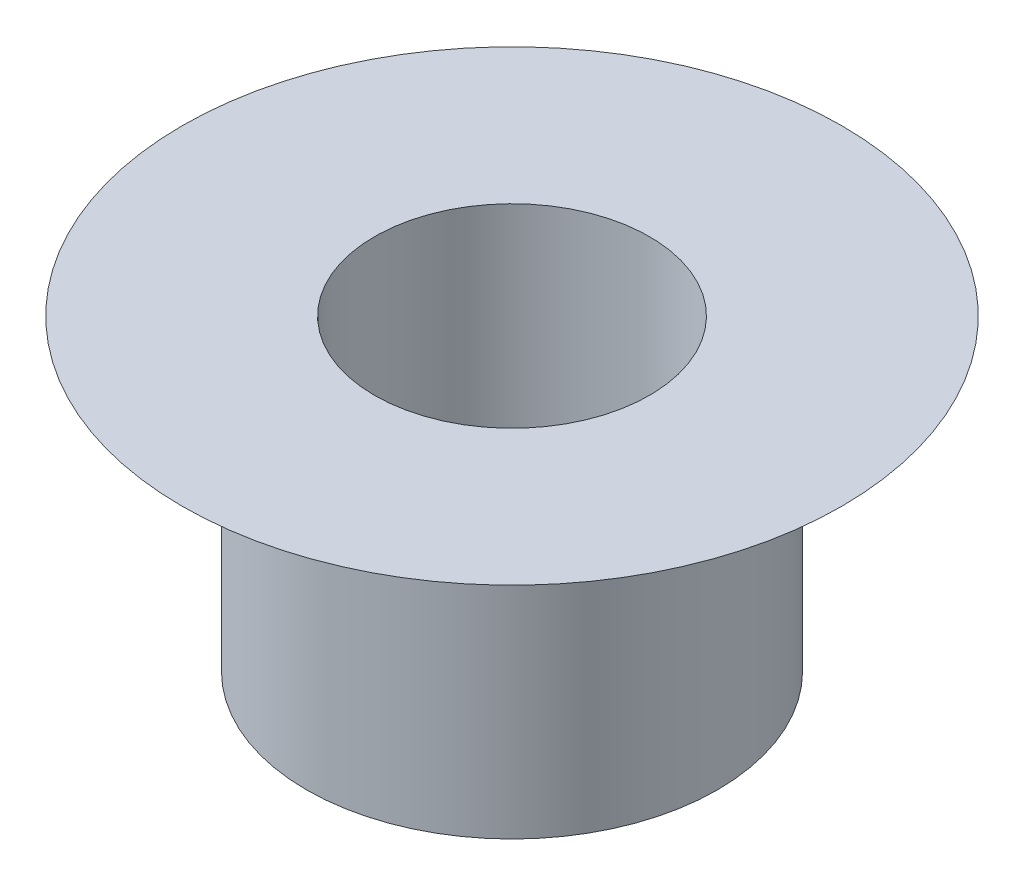
from build123d import *

# Parameters (mm, degrees)
SKETCH2_R          = 28.779824358
CUT_EXTRUDE1_DEPTH = 117.91191478


with BuildPart() as part:
    # Sketch1 → Revolve1 (revolve)
    with BuildSketch(Plane.XY, mode=Mode.PRIVATE) as revolve1_sk:
        Polygon((0, -49.516245434), (-43, -49.516245434), (-43, 4.483754566), (-68.999417602, 14.877516366), (0, 14.877516366), align=None)
    revolve(revolve1_sk.sketch.rotate(Axis((0, 75.515469597, 0), (0, -1, 0)), 270), axis=Axis((0, 75.515469597, 0), (0, -1, 0)))

    # Sketch2 → Cut-Extrude1 (cut, through all)
    with BuildSketch(Plane(origin=(0, 14.877516366, 0), x_dir=(1, 0, 0), z_dir=(0, 1, 0))):
        with Locations(Location((0, 0, 0), (0, 0, 270))):
            Circle(SKETCH2_R)
    extrude(amount=-CUT_EXTRUDE1_DEPTH, mode=Mode.SUBTRACT)


solid = part.part
